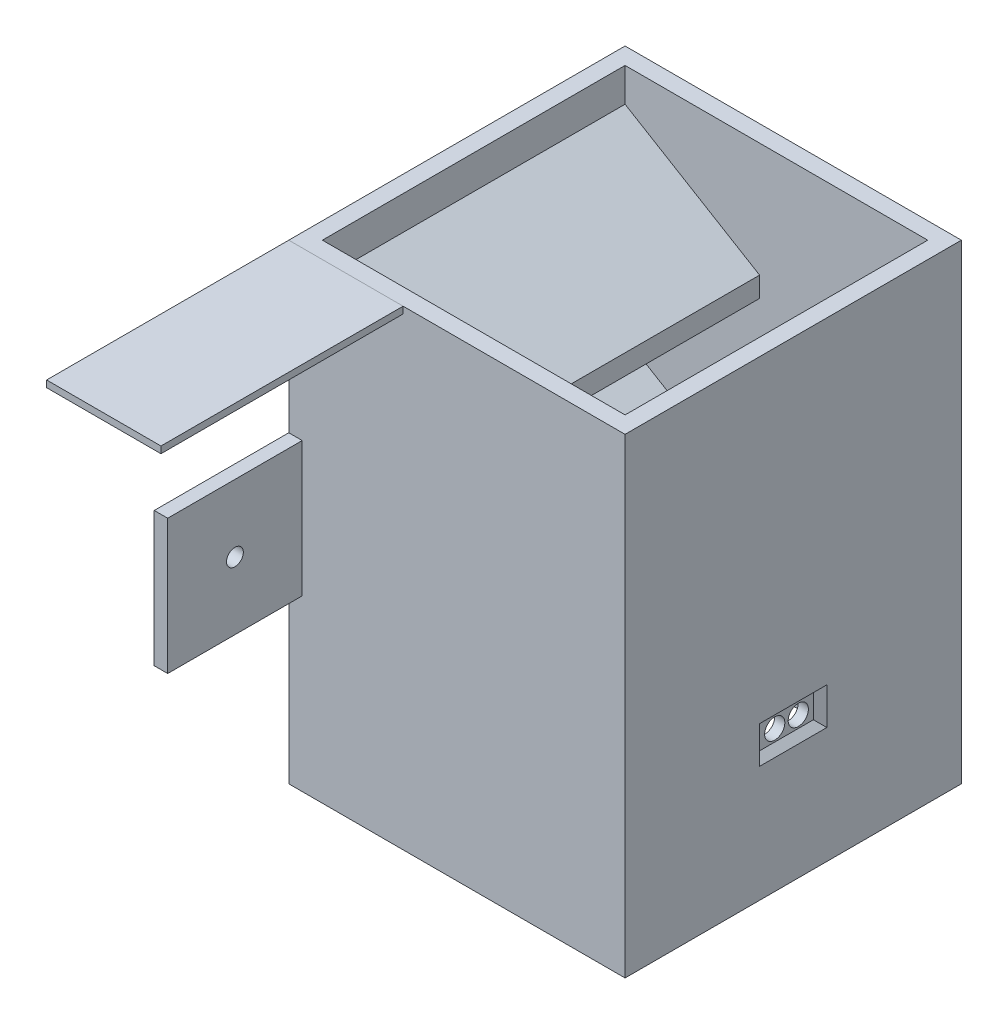
from build123d import *

# Parameters (mm, degrees)
CROQUIS2_W              = 50
CROQUIS2_H              = 50
CROQUIS2_W_2            = 45
CROQUIS2_H_2            = 45
SALIENTE_EXTRUIR1_DEPTH = 70
CROQUIS3_W              = 20
CROQUIS3_H              = 15
SALIENTE_EXTRUIR2_DEPTH = 45
CORTAR_EXTRUIR1_DEPTH   = 45
CROQUIS5_W              = 20
CROQUIS5_H              = 15
SALIENTE_EXTRUIR3_DEPTH = 45
CORTAR_EXTRUIR2_DEPTH   = 45
CROQUIS7_W              = 20
CROQUIS7_H              = 15
SALIENTE_EXTRUIR4_DEPTH = 45
CORTAR_EXTRUIR3_DEPTH   = 45
CROQUIS10_W             = 17
CROQUIS10_H             = 36
SALIENTE_EXTRUIR6_DEPTH = 1
CROQUIS12_W             = 20
CROQUIS12_H             = 20
CROQUIS12_R             = 1.25
SALIENTE_EXTRUIR7_DEPTH = 2
CROQUIS13_W             = 10
CROQUIS13_H             = 5.5
CORTAR_EXTRUIR4_DEPTH   = 1
CORTAR_EXTRUIR4_DRAFT   = -45
CROQUIS14_R             = 1.5
CORTAR_EXTRUIR5_DEPTH   = 2.5


with BuildPart() as part:
    # Croquis2 → Saliente-Extruir1 (new body)
    with BuildSketch(Plane(origin=(0, 0, 0), x_dir=(1, 0, 0), z_dir=(0, 1, 0))):
        with Locations((-2245.968468468, 11.373873874)):
            Rectangle(CROQUIS2_W, CROQUIS2_H)
        with Locations((-2245.968468468, 11.373873874)):
            Rectangle(CROQUIS2_W_2, CROQUIS2_H_2, mode=Mode.SUBTRACT)
    extrude(amount=SALIENTE_EXTRUIR1_DEPTH)

    # Croquis3 → Saliente-Extruir2 (add)
    with BuildSketch(Plane(origin=(0, 0, 11.126126126), x_dir=(-1, 0, 0), z_dir=(0, 0, -1))):
        with Locations((2258.468468468, 57.5)):
            Rectangle(CROQUIS3_W, CROQUIS3_H)
    extrude(amount=SALIENTE_EXTRUIR2_DEPTH)

    # Croquis4 → Cortar-Extruir1 (cut)
    with BuildSketch(Plane(origin=(0, 0, 11.126126126), x_dir=(-1, 0, 0), z_dir=(0, 0, -1))):
        Polygon((2248.468468468, 65), (2268.468468468, 65), (2248.468468468, 53), align=None)
        Polygon((2248.468468468, 50), (2268.468468468, 50), (2268.468468468, 62), align=None)
    extrude(amount=CORTAR_EXTRUIR1_DEPTH, mode=Mode.SUBTRACT)

    # Croquis5 → Saliente-Extruir3 (add)
    with BuildSketch(Plane(origin=(0, 0, 11.126126126), x_dir=(-1, 0, 0), z_dir=(0, 0, -1))):
        with Locations((2233.468468468, 42.5)):
            Rectangle(CROQUIS5_W, CROQUIS5_H)
    extrude(amount=SALIENTE_EXTRUIR3_DEPTH)

    # Croquis6 → Cortar-Extruir2 (cut)
    with BuildSketch(Plane(origin=(0, 0, 11.126126126), x_dir=(-1, 0, 0), z_dir=(0, 0, -1))):
        Polygon((2223.468468468, 50), (2243.468468468, 50), (2243.468468468, 38), align=None)
        Polygon((2223.468468468, 35), (2243.468468468, 35), (2223.468468468, 47), align=None)
    extrude(amount=CORTAR_EXTRUIR2_DEPTH, mode=Mode.SUBTRACT)

    # Croquis7 → Saliente-Extruir4 (add)
    with BuildSketch(Plane(origin=(0, 0, 11.126126126), x_dir=(-1, 0, 0), z_dir=(0, 0, -1))):
        with Locations((2258.468468468, 27.5)):
            Rectangle(CROQUIS7_W, CROQUIS7_H)
    extrude(amount=SALIENTE_EXTRUIR4_DEPTH)

    # Croquis8 → Cortar-Extruir3 (cut)
    with BuildSketch(Plane(origin=(0, 0, 11.126126126), x_dir=(-1, 0, 0), z_dir=(0, 0, -1))):
        Polygon((2248.468468468, 35), (2268.468468468, 35), (2248.468468468, 23), align=None)
        Polygon((2268.468468468, 20), (2248.468468468, 20), (2268.468468468, 32), align=None)
    extrude(amount=CORTAR_EXTRUIR3_DEPTH, mode=Mode.SUBTRACT)

    # Croquis12 → Saliente-Extruir7 (add)
    # profile 1 of 2: a face of its own
    with BuildSketch(Plane.ZY.offset(2270.968468468)):
        with Locations((-46.373873874, 35.201264481)):
            Rectangle(CROQUIS12_W, CROQUIS12_H)
        with Locations((-46.373873874, 35.201264481)):
            Circle(CROQUIS12_R, mode=Mode.SUBTRACT)
    # profile 2 of 2: a face of its own
    with BuildSketch(Plane.ZY.offset(2270.968468468)):
        with Locations((23.626126126, 35.201264481)):
            Rectangle(CROQUIS12_W, CROQUIS12_H)
        with Locations((23.626126126, 35.201264481)):
            Circle(CROQUIS12_R, mode=Mode.SUBTRACT)
    extrude(amount=-SALIENTE_EXTRUIR7_DEPTH)


with BuildPart() as body_2:
    # Croquis10 → Saliente-Extruir6 (new body)
    with BuildSketch(Plane(origin=(0, 70, 0), x_dir=(1, 0, 0), z_dir=(0, 1, 0))):
        with Locations((-2262.468468468, -31.626126126)):
            Rectangle(CROQUIS10_W, CROQUIS10_H)
    extrude(amount=-SALIENTE_EXTRUIR6_DEPTH)


with BuildPart() as cortar_extruir4_tool:
    # Croquis13 → Cortar-Extruir4 (with draft: the straight prism first)
    with BuildSketch(Plane(origin=(-2220.968468468, 0, 0), x_dir=(0, 0, -1), z_dir=(1, 0, 0))):
        with Locations((11.373873874, 20)):
            Rectangle(CROQUIS13_W, CROQUIS13_H)
    extrude(amount=-CORTAR_EXTRUIR4_DEPTH)
    # Cortar-Extruir4: the draft: its side faces are tilted about the plane it starts from
    cortar_extruir4_sides = [cortar_extruir4_tool.faces().sort_by_distance(p)[0] for p in [
        (-2221.468468468, 20, -6.373873874),
        (-2221.468468468, 17.25, -11.373873874),
        (-2221.468468468, 20, -16.373873874),
        (-2221.468468468, 22.75, -11.373873874),
    ]]
    draft(cortar_extruir4_sides, Plane(origin=(-2220.968468468, 0, 0), x_dir=(0, 0, -1), z_dir=(1, 0, 0)), CORTAR_EXTRUIR4_DRAFT)


with BuildPart() as part_1:
    add(part.part)

    # Cortar-Extruir4: cut by cortar_extruir4_tool
    add(cortar_extruir4_tool.part, mode=Mode.SUBTRACT)

    # Croquis14 → Cortar-Extruir5 (cut)
    with BuildSketch(Plane(origin=(-2220.968468468, 0, 0), x_dir=(0, 0, -1), z_dir=(1, 0, 0))):
        with Locations((9.623873874, 20)):
            Circle(CROQUIS14_R)
        with Locations((13.123873874, 20)):
            Circle(CROQUIS14_R)
    extrude(amount=-CORTAR_EXTRUIR5_DEPTH, mode=Mode.SUBTRACT)


solid = Compound([body_2.part, part_1.part])
